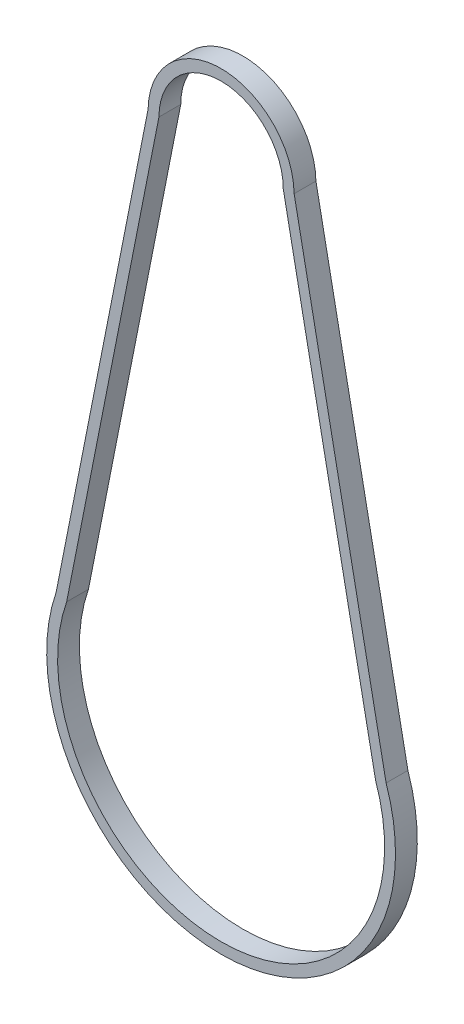
from build123d import *

# Parameters (mm, degrees)
BOSS_EXTRUDE2_DEPTH = 0.5


with BuildPart() as part:
    # Sketch1 → Boss-Extrude2 (new, symmetric)
    with BuildSketch(Plane.XY):
        with BuildLine():
            Line((-3.349611693, 31.391004962), (-7.568829969, 10.090909665))
            ThreePointArc((-7.568829969, 10.090909665), (0, -0.5), (7.568829969, 10.090909665))
            Line((7.568829969, 10.090909665), (3.349611693, 31.391004962))
            ThreePointArc((3.349611693, 31.391004962), (0, 34.69), (-3.349611693, 31.391004962))
        make_face()
        with BuildLine():
            Line((-2.85, 31.34), (-7.084997331, 9.960246496))
            ThreePointArc((-7.084997331, 9.960246496), (0, 0), (7.084997331, 9.960246496))
            Line((7.084997331, 9.960246496), (2.85, 31.34))
            ThreePointArc((2.85, 31.34), (0, 34.19), (-2.85, 31.34))
        make_face(mode=Mode.SUBTRACT)
    extrude(amount=BOSS_EXTRUDE2_DEPTH, both=True)


solid = part.part
